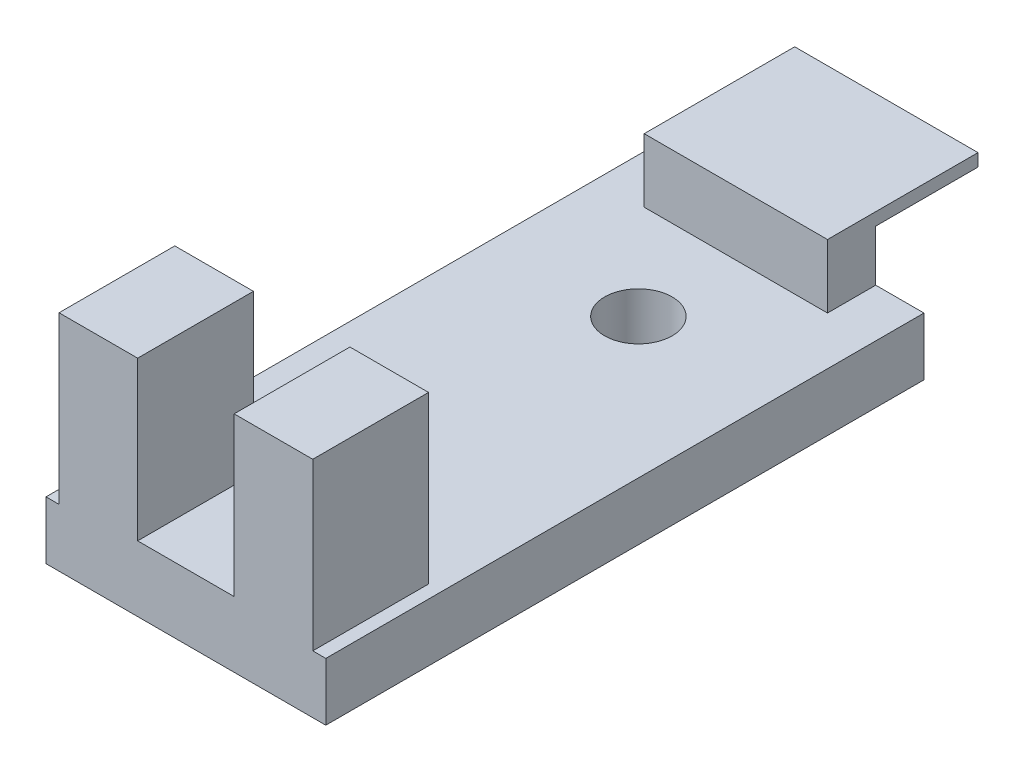
from build123d import *

# Parameters (mm, degrees)
BOSS_EXTRUDE1_DEPTH      = 7.25
BOSS_EXTRUDE1_DEPTH_BACK = 7.25
SKETCH2_W                = 2.5
SKETCH2_H                = 7.8
SKETCH2_W_2              = 0.675
SKETCH2_H_2              = 6
CUT_EXTRUDE1_DEPTH       = 24.646617094
SKETCH3_W                = 5
SKETCH3_H                = 6
CUT_EXTRUDE2_DEPTH       = 8.2
SKETCH4_R                = 1.75
CUT_EXTRUDE3_DEPTH       = 24.646617094


with BuildPart() as part:
    # Sketch1 → Boss-Extrude1 (new, two sides: drawn at the far end of the back side and taken through both)
    with BuildSketch(Plane(origin=(0, 0, 0), x_dir=(0, 0, -1), z_dir=(1, 0, 0)).offset(-BOSS_EXTRUDE1_DEPTH_BACK)):
        Polygon((-15.5, 0), (15.5, 0), (15.5, 5.65), (20.8, 5.65), (20.8, 6.3), (13, 6.3), (13, 3), (-9.5, 3), (-9.5, 11.6), (-15.5, 11.6), align=None)
    extrude(amount=BOSS_EXTRUDE1_DEPTH + BOSS_EXTRUDE1_DEPTH_BACK)

    # Sketch2 → Cut-Extrude1 (cut, through all)
    with BuildSketch(Plane(origin=(0, 3, 0), x_dir=(1, 0, 0), z_dir=(0, 1, 0))):
        with Locations((-6, 16.9)):
            Rectangle(SKETCH2_W, SKETCH2_H)
        with Locations((6, 16.9)):
            Rectangle(SKETCH2_W, SKETCH2_H)
        with Locations((-6.9125, -12.5)):
            Rectangle(SKETCH2_W_2, SKETCH2_H_2)
        with Locations((6.9125, -12.5)):
            Rectangle(SKETCH2_W_2, SKETCH2_H_2)
    extrude(amount=CUT_EXTRUDE1_DEPTH, mode=Mode.SUBTRACT)

    # Sketch3 → Cut-Extrude2 (cut)
    with BuildSketch(Plane(origin=(0, 11.6, 0), x_dir=(1, 0, 0), z_dir=(0, 1, 0))):
        with Locations((0, -12.5)):
            Rectangle(SKETCH3_W, SKETCH3_H)
    extrude(amount=-CUT_EXTRUDE2_DEPTH, mode=Mode.SUBTRACT)

    # Sketch4 → Cut-Extrude3 (cut, through all)
    with BuildSketch(Plane(origin=(0, 3, 0), x_dir=(1, 0, 0), z_dir=(0, 1, 0))):
        with Locations((0, 7.95)):
            Circle(SKETCH4_R)
    extrude(amount=-CUT_EXTRUDE3_DEPTH, mode=Mode.SUBTRACT)


solid = part.part
